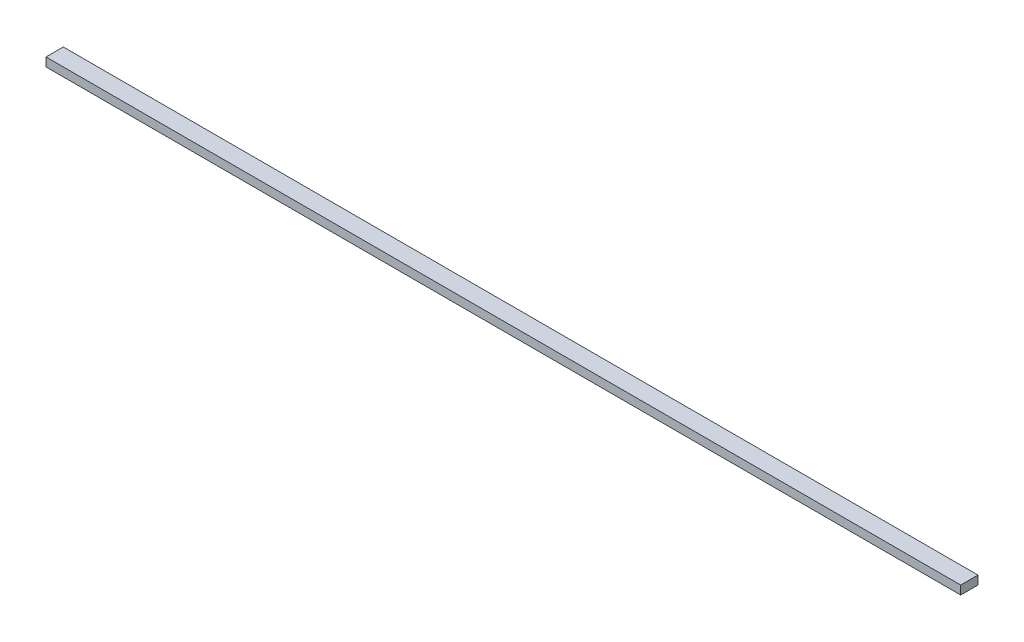
from build123d import *

# Parameters (mm, degrees)
SKETCH1_W           = 671.5125
SKETCH1_H           = 6.35
BOSS_EXTRUDE1_DEPTH = 12.7


with BuildPart() as part:
    # Sketch1 → Boss-Extrude1 (new body)
    with BuildSketch(Plane.XY):
        Rectangle(SKETCH1_W, SKETCH1_H)
    extrude(amount=BOSS_EXTRUDE1_DEPTH)


solid = part.part
